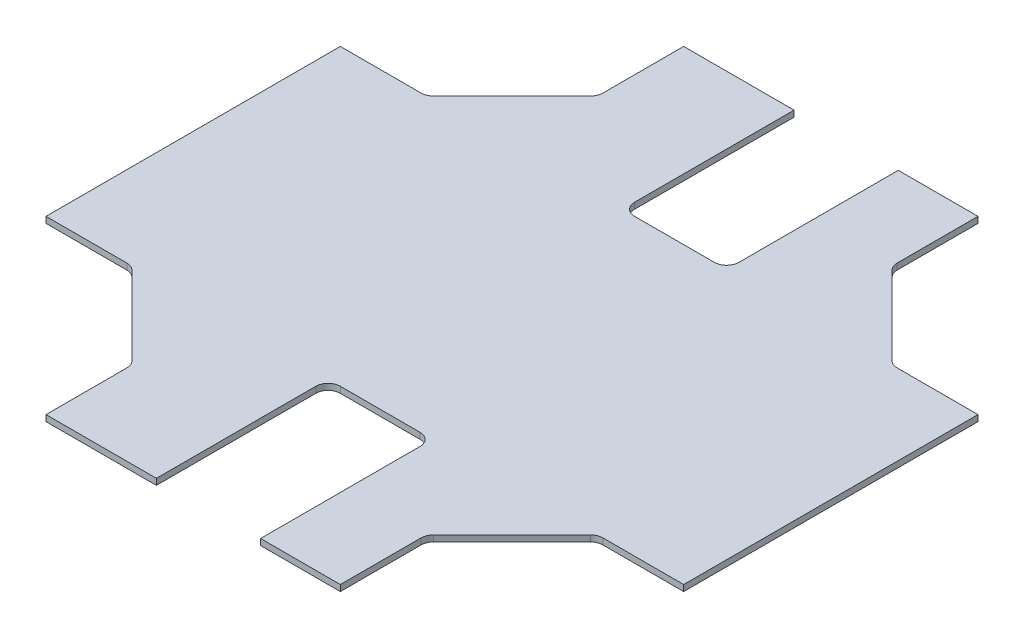
from build123d import *

# Parameters (mm, degrees)
BOSS_EXTRUDE1_DEPTH = 6.35
CUT_EXTRUDE2_DEPTH  = 468.016490608
FILLET1_R           = 12.7


with BuildPart() as part:
    # Sketch1 → Boss-Extrude1 (new body)
    with BuildSketch(Plane(origin=(0, 0, 0), x_dir=(1, 0, 0), z_dir=(0, 1, 0))):
        Polygon((-330.2, 152.4), (-330.2, -152.4), (-241.3, -152.4), (-152.4, -241.3), (-152.4, -330.2), (152.4, -330.2), (152.4, -241.3), (241.3, -152.4), (330.2, -152.4), (330.2, 152.4), (241.3, 152.4), (152.4, 241.3), (152.4, 330.2), (-152.4, 330.2), (-152.4, 241.3), (-241.3, 152.4), align=None)
    extrude(amount=BOSS_EXTRUDE1_DEPTH)

    # Sketch3 → Cut-Extrude2 (cut, through all)
    with BuildSketch(Plane(origin=(0, 6.35, 0), x_dir=(1, 0, 0), z_dir=(0, 1, 0))):
        with BuildLine():
            Line((69.85, 330.2), (-38.1, 330.2))
            Line((-38.1, 330.2), (-38.1, 165.1))
            ThreePointArc((-38.1, 165.1), (-34.380256121, 156.119743879), (-25.4, 152.4))
            Line((-25.4, 152.4), (57.15, 152.4))
            ThreePointArc((57.15, 152.4), (66.130256121, 156.119743879), (69.85, 165.1))
            Line((69.85, 165.1), (69.85, 330.2))
        make_face()
        with BuildLine():
            Line((69.85, -330.2), (-38.1, -330.2))
            Line((-38.1, -330.2), (-38.1, -165.1))
            ThreePointArc((-38.1, -165.1), (-34.380256121, -156.119743879), (-25.4, -152.4))
            Line((-25.4, -152.4), (57.15, -152.4))
            ThreePointArc((57.15, -152.4), (66.130256121, -156.119743879), (69.85, -165.1))
            Line((69.85, -165.1), (69.85, -330.2))
        make_face()
    extrude(amount=-CUT_EXTRUDE2_DEPTH, mode=Mode.SUBTRACT)

    # Fillet1
    fillet1_edges = [part.edges().sort_by_distance(p)[0] for p in [
        (152.4, 3.175, 241.3),
        (-152.4, 3.175, 241.3),
        (-241.3, 3.175, 152.4),
        (-241.3, 3.175, -152.4),
        (-152.4, 3.175, -241.3),
        (152.4, 3.175, -241.3),
        (241.3, 3.175, -152.4),
        (241.3, 3.175, 152.4),
    ]]
    fillet(fillet1_edges, radius=FILLET1_R)


solid = part.part
